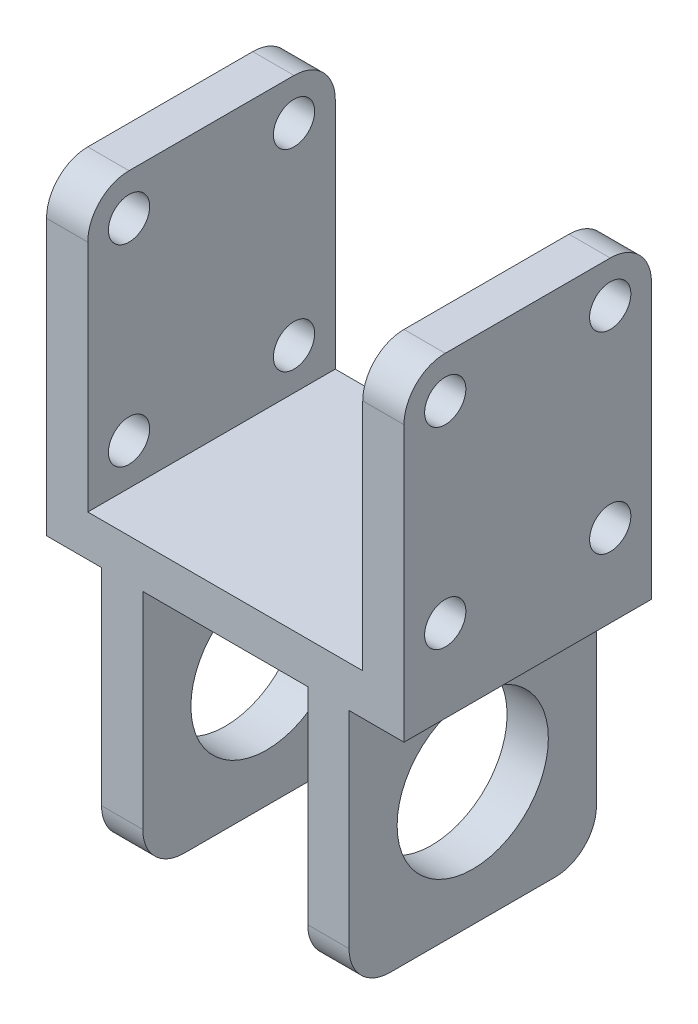
from build123d import *

# Parameters (mm, degrees)
SKETCH_1_W          = 26
SKETCH_1_H          = 18
EXTRUDE_1_DEPTH     = 3
SKETCH_2_W          = 3
SKETCH_2_H          = 18
EXTRUDE_2_DEPTH     = 20
SKETCH_3_W          = 3
SKETCH_3_H          = 18
EXTRUDE_3_DEPTH     = 18
SKETCH_4_R          = 1.5
CUT_EXTRUDE_1_DEPTH = 36.860842154
FILLET_1_R          = 3
SKETCH_5_R          = 5.5
CUT_EXTRUDE_2_DEPTH = 36.860842154
FILLET_2_R          = 3


with BuildPart() as part:
    # 草图1 → 凸台-拉伸1 (new body)
    with BuildSketch(Plane(origin=(0, 0, 0), x_dir=(1, 0, 0), z_dir=(0, 1, 0))):
        Rectangle(SKETCH_1_W, SKETCH_1_H)
    extrude(amount=EXTRUDE_1_DEPTH)

    # 草图2 → 凸台-拉伸2 (add)
    with BuildSketch(Plane(origin=(0, 3, 0), x_dir=(1, 0, 0), z_dir=(0, 1, 0))):
        with Locations((-11.5, 0)):
            Rectangle(SKETCH_2_W, SKETCH_2_H)
        with Locations((11.5, 0)):
            Rectangle(SKETCH_2_W, SKETCH_2_H)
    extrude(amount=EXTRUDE_2_DEPTH)

    # 草图3 → 凸台-拉伸3 (add)
    with BuildSketch(Plane.XZ):
        with Locations((-7.5, 0)):
            Rectangle(SKETCH_3_W, SKETCH_3_H)
        with Locations((7.5, 0)):
            Rectangle(SKETCH_3_W, SKETCH_3_H)
    extrude(amount=EXTRUDE_3_DEPTH)

    # 草图4 → 切除-拉伸1 (cut, through all)
    with BuildSketch(Plane.ZY.offset(13)):
        with Locations((-6, 20)):
            Circle(SKETCH_4_R)
        with Locations(Location((6, 20, 0), (0, 0, 180))):
            Circle(SKETCH_4_R)
        with Locations((6, 6)):
            Circle(SKETCH_4_R)
        with Locations(Location((-6, 6, 0), (0, 0, 180))):
            Circle(SKETCH_4_R)
    extrude(amount=-CUT_EXTRUDE_1_DEPTH, mode=Mode.SUBTRACT)

    # 圆角1
    fillet_1_edges = [part.edges().sort_by_distance(p)[0] for p in [
        (-11.5, 23, 9),
        (-11.5, 23, -9),
        (11.5, 23, -9),
        (11.5, 23, 9),
    ]]
    fillet(fillet_1_edges, radius=FILLET_1_R)

    # 草图5 → 切除-拉伸2 (cut, through all)
    with BuildSketch(Plane.ZY.offset(13)):
        with Locations((0, -9)):
            Circle(SKETCH_5_R)
    extrude(amount=-CUT_EXTRUDE_2_DEPTH, mode=Mode.SUBTRACT)

    # 圆角2
    fillet_2_edges = [part.edges().sort_by_distance(p)[0] for p in [
        (-7.5, -18, -9),
        (-7.5, -18, 9),
        (7.5, -18, 9),
        (7.5, -18, -9),
    ]]
    fillet(fillet_2_edges, radius=FILLET_2_R)


solid = part.part
